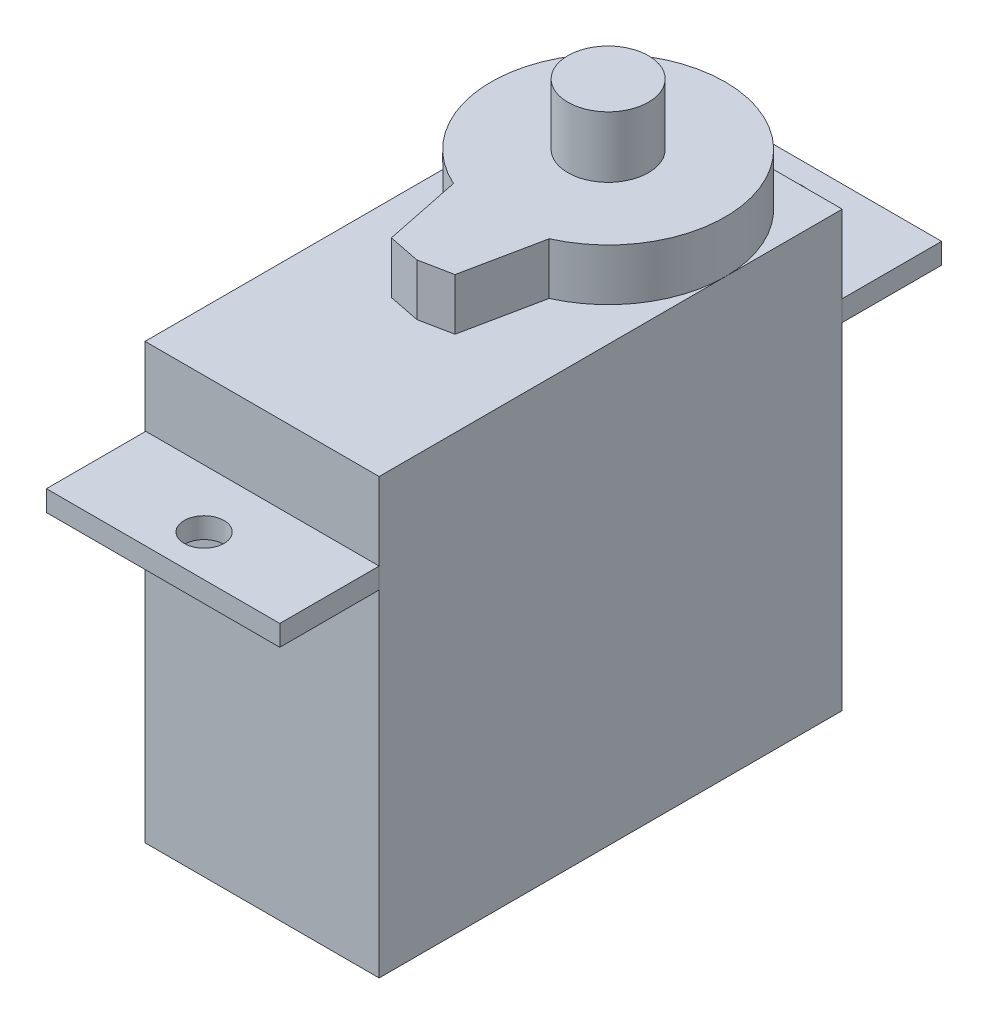
from build123d import *

# Parameters (mm, degrees)
SKETCH1_W             = 11.5
SKETCH1_H             = 22.75
BOSS_EXTRUDE1_DEPTH   = 23.876
SKETCH2_W             = 11.465
SKETCH2_H             = 4.881
SKETCH2_R             = 0.9779
BOSS_EXTRUDE2_DEPTH   = 1.016
BOSS_EXTRUDE2_2_DEPTH = 1.016
CUT_EXTRUDE2_DEPTH    = 2.54
SKETCH4_R             = 1.9812
BOSS_EXTRUDE3_DEPTH   = 3


with BuildPart() as part:
    # Sketch1 → Boss-Extrude1 (new body)
    with BuildSketch(Plane(origin=(0, 0, 0), x_dir=(1, 0, 0), z_dir=(0, 1, 0))):
        Rectangle(SKETCH1_W, SKETCH1_H)
    extrude(amount=BOSS_EXTRUDE1_DEPTH)

    # Sketch3 → Cut-Extrude2 (cut)
    with BuildSketch(Plane(origin=(0, 23.876, 0), x_dir=(1, 0, 0), z_dir=(0, 1, 0))):
        with BuildLine():
            Line((2.351147049, 0.377657096), (1.562534553, -3.459897938))
            Line((1.562534553, -3.459897938), (0, -3.772404849))
            Line((0, -3.772404849), (-1.562534553, -3.459897938))
            Line((-1.562534553, -3.459897938), (-2.351147049, 0.377657096))
            ThreePointArc((-2.351147049, 0.377657096), (-4.826054057, 2.499027794), (-5.75, 5.625))
            Line((-5.75, 5.625), (-5.75, -11.375))
            Line((-5.75, -11.375), (5.75, -11.375))
            Line((5.75, -11.375), (5.75, 5.625))
            ThreePointArc((5.75, 5.625), (4.826054057, 2.499027794), (2.351147049, 0.377657096))
        make_face()
        with BuildLine():
            ThreePointArc((0, 11.375), (4.065863992, 9.690863992), (5.75, 5.625))
            Line((5.75, 5.625), (5.75, 11.375))
            Line((5.75, 11.375), (0, 11.375))
        make_face()
        with BuildLine():
            ThreePointArc((-5.75, 5.625), (-4.065863992, 9.690863992), (0, 11.375))
            Line((0, 11.375), (-5.75, 11.375))
            Line((-5.75, 11.375), (-5.75, 5.625))
        make_face()
    extrude(amount=-CUT_EXTRUDE2_DEPTH, mode=Mode.SUBTRACT)

    # Sketch4 → Boss-Extrude3 (add)
    with BuildSketch(Plane(origin=(0, 23.876, 0), x_dir=(1, 0, 0), z_dir=(0, 1, 0))):
        with Locations(Location((0, 5.625, 0), (0, 0, 270))):
            Circle(SKETCH4_R)
    extrude(amount=BOSS_EXTRUDE3_DEPTH)


with BuildPart() as body_2:
    # Sketch2 → Boss-Extrude2 (new body)
    with BuildSketch(Plane(origin=(0, 16.51, 0), x_dir=(-1, 0, 0), z_dir=(0, 1, 0))):
        with Locations((-0.0175, -13.8155)):
            Rectangle(SKETCH2_W, SKETCH2_H)
        with Locations(Location((0, -14.224, 0), (0, 0, 90))):
            Circle(SKETCH2_R, mode=Mode.SUBTRACT)
    extrude(amount=BOSS_EXTRUDE2_DEPTH)


with BuildPart() as body_3:
    # Sketch2 → Boss-Extrude2 2 (new body)
    with BuildSketch(Plane(origin=(0, 16.51, 0), x_dir=(-1, 0, 0), z_dir=(0, 1, 0))):
        with Locations((-0.0175, 13.8155)):
            Rectangle(SKETCH2_W, SKETCH2_H)
        with Locations(Location((0, 14.224, 0), (0, 0, 90))):
            Circle(SKETCH2_R, mode=Mode.SUBTRACT)
    extrude(amount=BOSS_EXTRUDE2_2_DEPTH)


solid = Compound([part.part, body_2.part, body_3.part])
